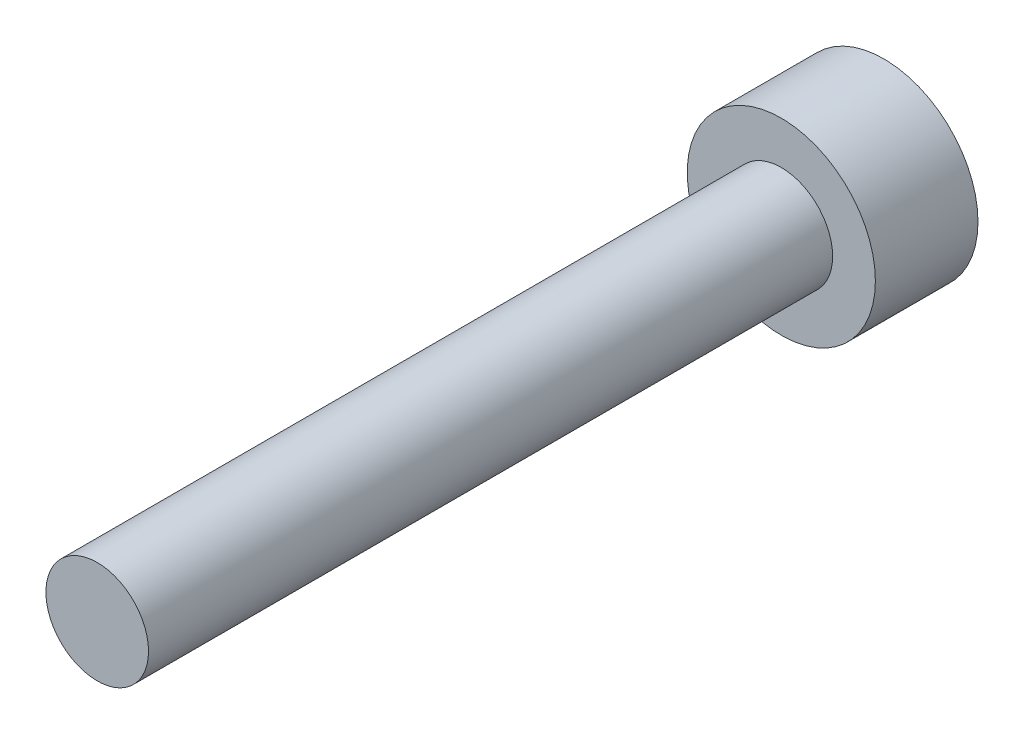
from build123d import *

# Parameters (mm, degrees)
F_01_START                = -3
S01_HEAD_R                = 2.75
F_01_HEAD_DEPTH           = 3
S02_NOMINAL_SHANK_R       = 1.5
F_02_NOMINAL_SHANK_DEPTH  = 20
F_03_START                = -3.1
F_03_HEX_KEY_SOCKET_DEPTH = 1.75


with BuildPart() as part:
    # S01 - Head → 01 - Head (new body)
    with BuildSketch(Plane.XY.offset(F_01_START)):
        Circle(S01_HEAD_R)
    extrude(amount=F_01_HEAD_DEPTH)

    # S02 - Nominal shank → 02 - Nominal shank (add)
    with BuildSketch(Plane.XY):
        Circle(S02_NOMINAL_SHANK_R)
    extrude(amount=F_02_NOMINAL_SHANK_DEPTH)

    # S03 - Hex key socket → 03 - Hex key socket (cut)
    with BuildSketch(Plane.XY.offset(F_03_START)):
        Polygon((1.443375673, 0), (0.721687836, 1.25), (-0.721687836, 1.25), (-1.443375673, 0), (-0.721687836, -1.25), (0.721687836, -1.25), align=None)
    extrude(amount=F_03_HEX_KEY_SOCKET_DEPTH, mode=Mode.SUBTRACT)


solid = part.part
